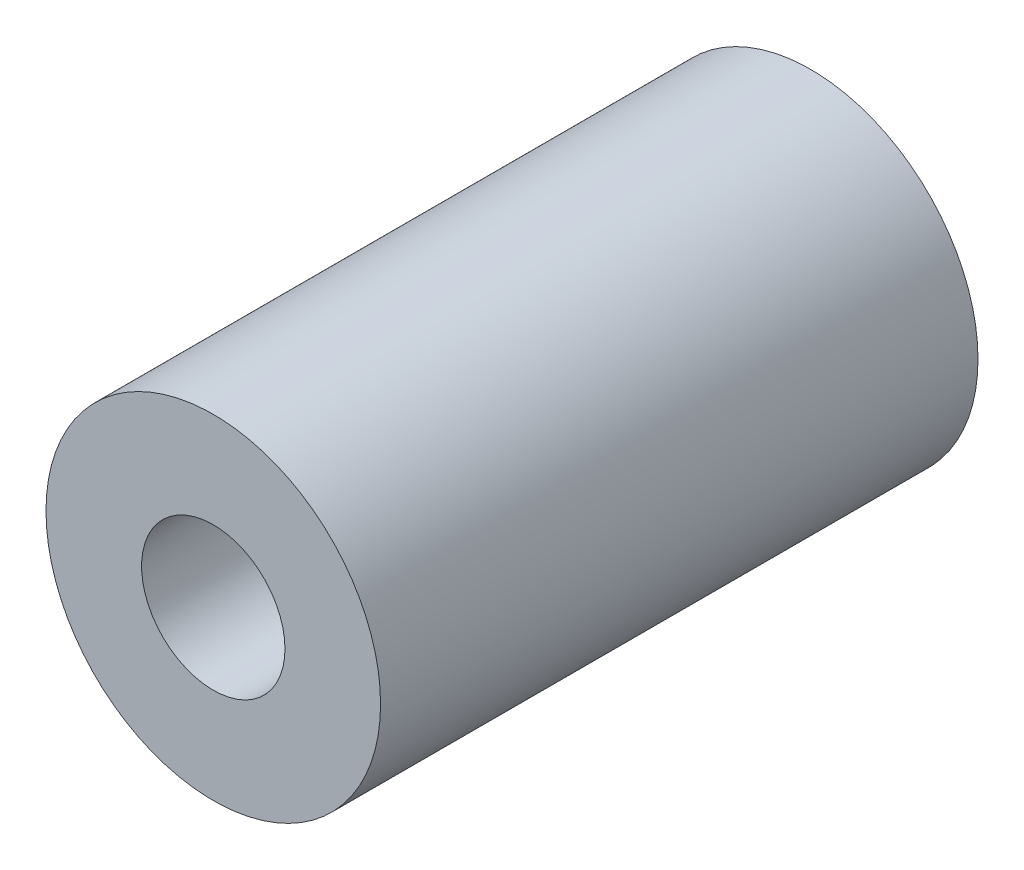
from build123d import *

# Parameters (mm, degrees)
SKETCH1_R           = 7
SKETCH1_R_2         = 3
BOSS_EXTRUDE1_DEPTH = 25


with BuildPart() as part:
    # Sketch1 → Boss-Extrude1 (new body)
    with BuildSketch(Plane.XY):
        Circle(SKETCH1_R)
        Circle(SKETCH1_R_2, mode=Mode.SUBTRACT)
    extrude(amount=BOSS_EXTRUDE1_DEPTH)


solid = part.part
